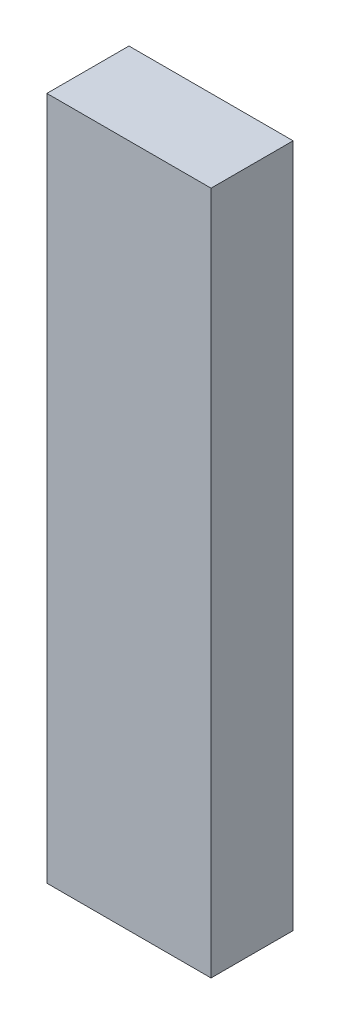
from build123d import *

# Parameters (mm, degrees)
SKETCH1_W        = 6
SKETCH1_H        = 3
KEY_6X3X25_DEPTH = 25


with BuildPart() as part:
    # Sketch1 → Key_6x3x25 (new body)
    with BuildSketch(Plane(origin=(0, 0, 0), x_dir=(1, 0, 0), z_dir=(0, 1, 0))):
        Rectangle(SKETCH1_W, SKETCH1_H)
    extrude(amount=KEY_6X3X25_DEPTH)


solid = part.part
